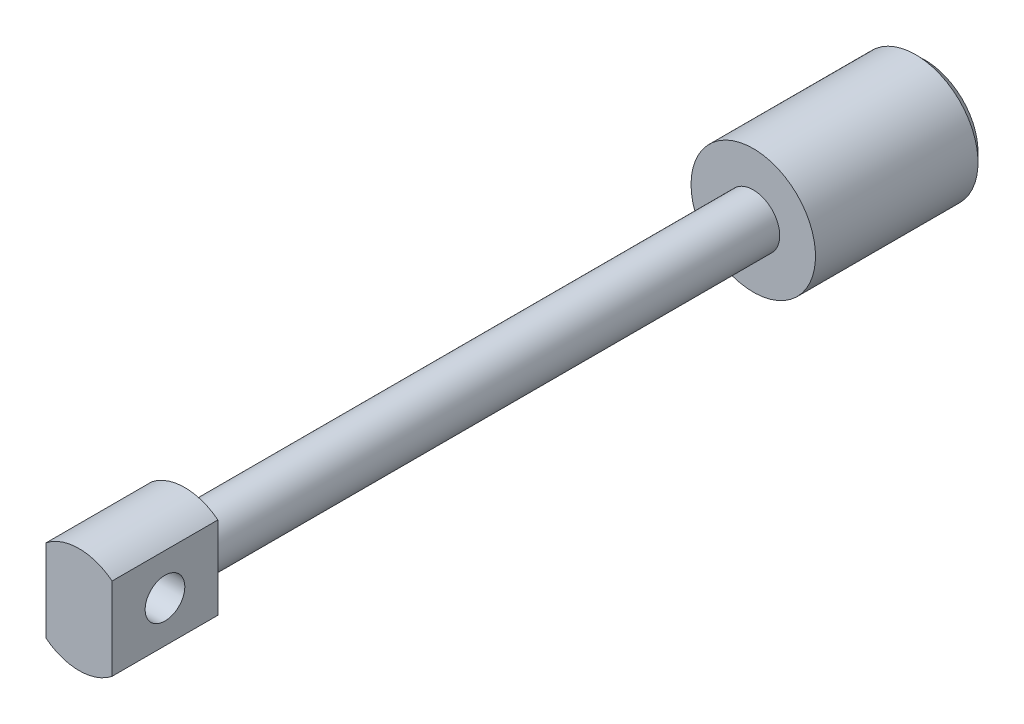
from build123d import *

# Parameters (mm, degrees)
ENL_V_START             = -16
ENL_V_MAT_EXTRU_1_DEPTH = 16
ENL_V_MAT_EXTRU_2_REACH = 131.153
ESQUISSE3_R             = 3


with BuildPart() as part:
    # Esquisse1 → Révolution1 (revolve)
    with BuildSketch(Plane(origin=(0, 0, 0), x_dir=(1, 0, 0), z_dir=(0, 1, 0))):
        Polygon((0, 0), (-8, 0), (-8, 16), (-4, 16), (-4, 102), (-9.414213562, 102), (-9.414213562, 126.585786438), (-8, 128), (0, 128), align=None)
    revolve(axis=Axis((0, 0, -128), (0, 0, 1)))

    # Esquisse2 → Enlèv. mat.-Extru.1 (cut)
    with BuildSketch(Plane.XY.offset(ENL_V_START)):
        Polygon((-5, 10), (-5, -12), (5, -12), (5, 10), (12, 10), (12, -15), (-12, -15), (-12, 10), align=None)
    extrude(amount=ENL_V_MAT_EXTRU_1_DEPTH, mode=Mode.SUBTRACT)

    # Esquisse3 → Enlèv. mat.-Extru.2 (cut, up to next)
    with BuildSketch(Plane.ZY.offset(5), mode=Mode.PRIVATE) as enl_v_mat_extru_2_sk1:
        with Locations(Location((-8, 0, 0), (0, 0, 270))):
            Circle(ESQUISSE3_R)
    enl_v_mat_extru_2_tool1 = extrude(enl_v_mat_extru_2_sk1.sketch, amount=-ENL_V_MAT_EXTRU_2_REACH, mode=Mode.PRIVATE) & part.part
    add(enl_v_mat_extru_2_tool1.solids().sort_by_distance((-5, 0, -8))[0], mode=Mode.SUBTRACT)


solid = part.part
